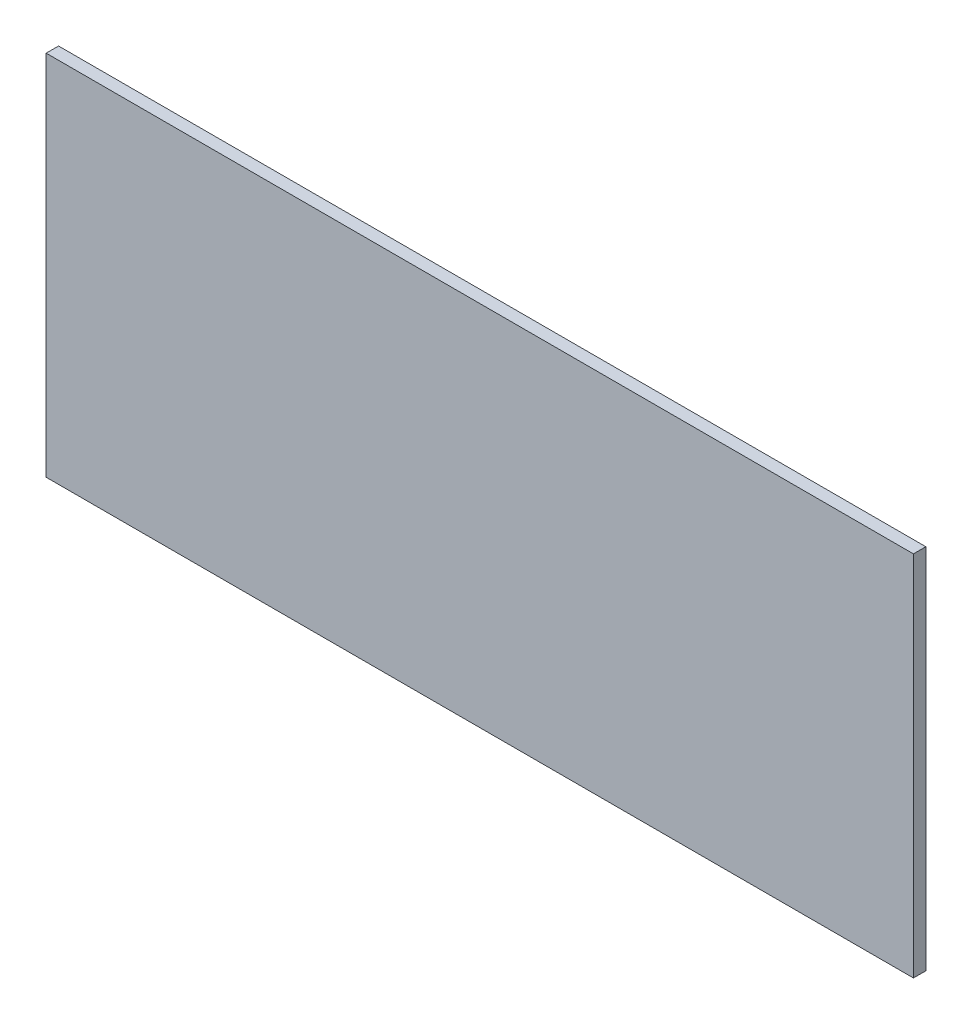
from build123d import *

# Parameters (mm, degrees)
SKETCH1_W           = 209.9056
SKETCH1_H           = 88.9
BOSS_EXTRUDE1_DEPTH = 3


with BuildPart() as part:
    # Sketch1 → Boss-Extrude1 (new body)
    with BuildSketch(Plane.XY):
        Rectangle(SKETCH1_W, SKETCH1_H)
    extrude(amount=BOSS_EXTRUDE1_DEPTH)


solid = part.part
